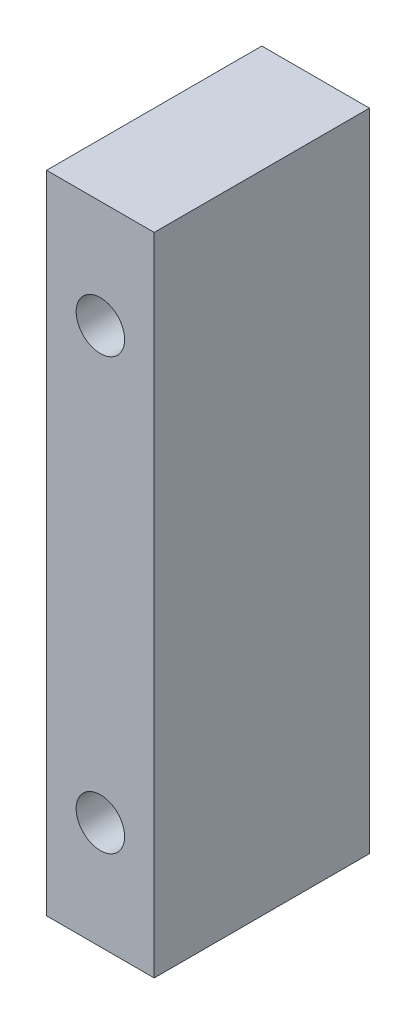
from build123d import *

# Parameters (mm, degrees)
SKETCH_1_W                  = 20
SKETCH_1_H                  = 120
SKETCH_1_R                  = 4.5
SLIDING_JAW_20X120X40_DEPTH = 40


with BuildPart() as part:
    # 草图1 → Sliding_jaw_20x120x40 (new body)
    with BuildSketch(Plane.XY):
        with Locations((10, 60)):
            Rectangle(SKETCH_1_W, SKETCH_1_H)
        with Locations((10, 20)):
            Circle(SKETCH_1_R, mode=Mode.SUBTRACT)
        with Locations((10, 100)):
            Circle(SKETCH_1_R, mode=Mode.SUBTRACT)
    extrude(amount=SLIDING_JAW_20X120X40_DEPTH)


solid = part.part
